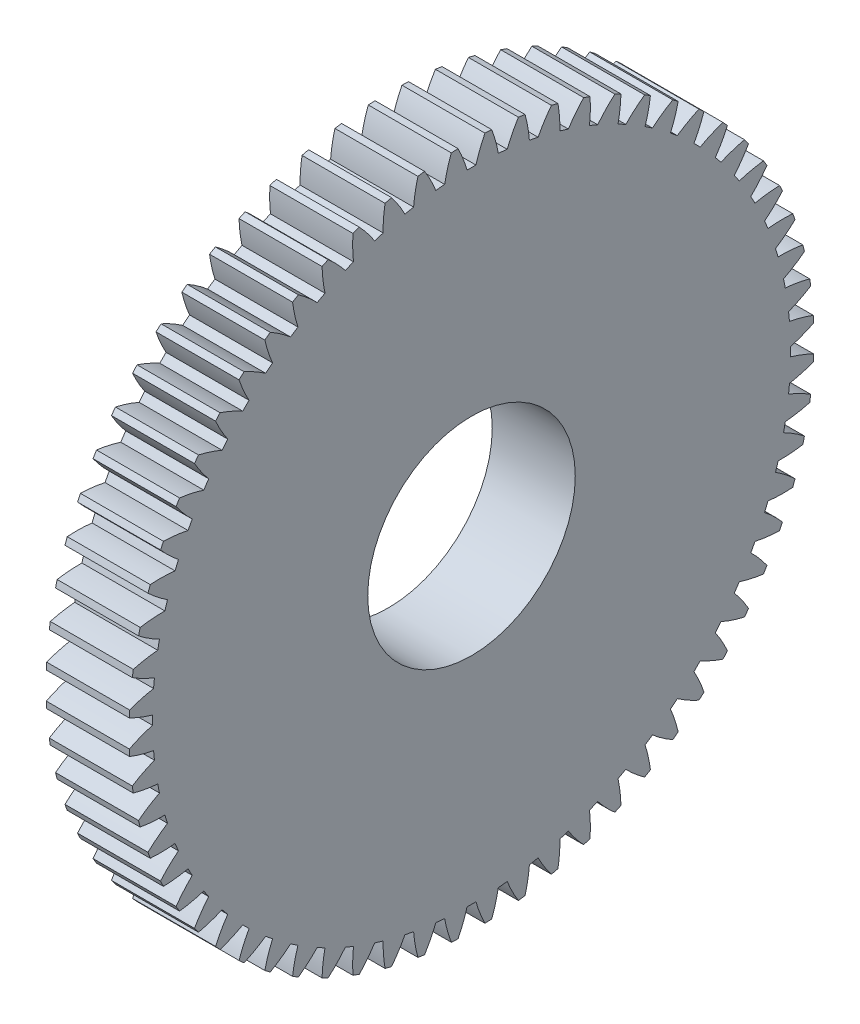
from build123d import *

# Parameters (mm, degrees)
BASPROSKE_W     = 4
BASPROSKE_H     = 16.5
TOOTHCUT_DEPTH  = 24.674881204
TEETHCUTS_COUNT = 64
TEETHCUTS_ANGLE = 354.375
BORSKE_R        = 5
BORE_DEPTH      = 50.0000508


with BuildPart() as part:
    # BasProSke → Base-Revolve (revolve)
    with BuildSketch(Plane(origin=(0, 0, 0), x_dir=(1, 0, 0), z_dir=(0, 1, 0)), mode=Mode.PRIVATE) as base_revolve_sk:
        with Locations((2, 8.25)):
            Rectangle(BASPROSKE_W, BASPROSKE_H)
    revolve(base_revolve_sk.sketch.rotate(Axis((-10, 0, 0), (1, 0, 0)), 180), axis=Axis((-10, 0, 0), (1, 0, 0)))

    # TooCutSke → ToothCut (cut, through all)
    with BuildSketch(Plane(origin=(0, 0, 0), x_dir=(0, 0, -1), z_dir=(1, 0, 0))):
        with BuildLine():
            ThreePointArc((0.213745605, 15.372514069), (0, 15.374), (-0.213745605, 15.372514069))
            ThreePointArc((-0.213745605, 15.372514069), (-0.40958083, 15.953057123), (-0.660031451, 16.512213772))
            ThreePointArc((-0.660031451, 16.512213772), (0, 16.5254), (0.660031451, 16.512213772))
            ThreePointArc((0.660031451, 16.512213772), (0.40958083, 15.953057123), (0.213745605, 15.372514069))
        make_face()
    toothcut = extrude(amount=TOOTHCUT_DEPTH, mode=Mode.SUBTRACT)

    # TeethCuts: ToothCut ×64 about axis
    teethcuts_axis = Axis((-10, 0, 0), (1, 0, 0))
    for i in range(1, TEETHCUTS_COUNT):
        add(toothcut.rotate(teethcuts_axis, i * TEETHCUTS_ANGLE / (TEETHCUTS_COUNT - 1)), mode=Mode.SUBTRACT)

    # BorSke → Bore (cut, symmetric)
    with BuildSketch(Plane(origin=(0, 0, 0), x_dir=(0, 0, -1), z_dir=(1, 0, 0))):
        with Locations(Location((0, 0, 0), (0, 0, 180))):
            Circle(BORSKE_R)
    extrude(amount=BORE_DEPTH, both=True, mode=Mode.SUBTRACT)


solid = part.part
